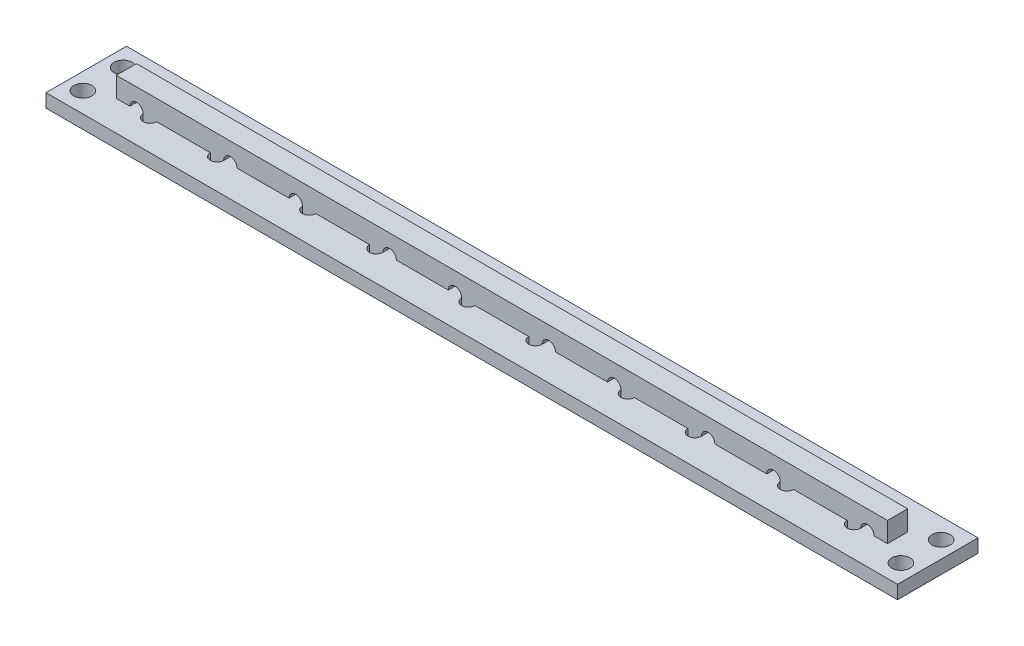
from build123d import *

# Parameters (mm, degrees)
SKETCH_1_W      = 127
SKETCH_1_H      = 12
SKETCH_1_R      = 1.35
EXTRUDE_1_DEPTH = 2
EXTRUDE_2_DEPTH = 3


with BuildPart() as part:
    # 草图1 → 凸台-拉伸1 (new body)
    with BuildSketch(Plane(origin=(0, 0, 0), x_dir=(1, 0, 0), z_dir=(0, 1, 0))):
        with Locations((63.5, 6)):
            Rectangle(SKETCH_1_W, SKETCH_1_H)
        with Locations(Location((2.5, 9, 0), (0, 0, 270))):
            Circle(SKETCH_1_R, mode=Mode.SUBTRACT)
        with Locations(Location((2.5, 3, 0), (0, 0, 90))):
            Circle(SKETCH_1_R, mode=Mode.SUBTRACT)
        with Locations(Location((124.5, 3, 0), (0, 0, 270))):
            Circle(SKETCH_1_R, mode=Mode.SUBTRACT)
        with Locations(Location((124.5, 9, 0), (0, 0, 90))):
            Circle(SKETCH_1_R, mode=Mode.SUBTRACT)
        with BuildLine():
            Line((12, 7.5), (20, 7.5))
            ThreePointArc((20, 7.5), (21, 8.5), (22, 7.5))
            Line((22, 7.5), (22, 4.5))
            ThreePointArc((22, 4.5), (21, 3.5), (20, 4.5))
            Line((20, 4.5), (12, 4.5))
            ThreePointArc((12, 4.5), (11, 3.5), (10, 4.5))
            Line((10, 4.5), (10, 7.5))
            ThreePointArc((10, 7.5), (11, 8.5), (12, 7.5))
        make_face(mode=Mode.SUBTRACT)
        with BuildLine():
            Line((35.75, 4.5), (43.75, 4.5))
            ThreePointArc((43.75, 4.5), (44.75, 3.5), (45.75, 4.5))
            Line((45.75, 4.5), (45.75, 7.5))
            ThreePointArc((45.75, 7.5), (44.75, 8.5), (43.75, 7.5))
            Line((43.75, 7.5), (35.75, 7.5))
            ThreePointArc((35.75, 7.5), (34.75, 8.5), (33.75, 7.5))
            Line((33.75, 7.5), (33.75, 4.5))
            ThreePointArc((33.75, 4.5), (34.75, 3.5), (35.75, 4.5))
        make_face(mode=Mode.SUBTRACT)
        with BuildLine():
            Line((59.5, 4.5), (67.5, 4.5))
            ThreePointArc((67.5, 4.5), (68.5, 3.5), (69.5, 4.5))
            Line((69.5, 4.5), (69.5, 7.5))
            ThreePointArc((69.5, 7.5), (68.5, 8.5), (67.5, 7.5))
            Line((67.5, 7.5), (59.5, 7.5))
            ThreePointArc((59.5, 7.5), (58.5, 8.5), (57.5, 7.5))
            Line((57.5, 7.5), (57.5, 4.5))
            ThreePointArc((57.5, 4.5), (58.5, 3.5), (59.5, 4.5))
        make_face(mode=Mode.SUBTRACT)
        with BuildLine():
            Line((83.25, 4.5), (91.25, 4.5))
            ThreePointArc((91.25, 4.5), (92.25, 3.5), (93.25, 4.5))
            Line((93.25, 4.5), (93.25, 7.5))
            ThreePointArc((93.25, 7.5), (92.25, 8.5), (91.25, 7.5))
            Line((91.25, 7.5), (83.25, 7.5))
            ThreePointArc((83.25, 7.5), (82.25, 8.5), (81.25, 7.5))
            Line((81.25, 7.5), (81.25, 4.5))
            ThreePointArc((81.25, 4.5), (82.25, 3.5), (83.25, 4.5))
        make_face(mode=Mode.SUBTRACT)
        with BuildLine():
            Line((107, 4.5), (115, 4.5))
            ThreePointArc((115, 4.5), (116, 3.5), (117, 4.5))
            Line((117, 4.5), (117, 7.5))
            ThreePointArc((117, 7.5), (116, 8.5), (115, 7.5))
            Line((115, 7.5), (107, 7.5))
            ThreePointArc((107, 7.5), (106, 8.5), (105, 7.5))
            Line((105, 7.5), (105, 4.5))
            ThreePointArc((105, 4.5), (106, 3.5), (107, 4.5))
        make_face(mode=Mode.SUBTRACT)
    extrude(amount=EXTRUDE_1_DEPTH)


with BuildPart() as body_2:
    # 草图2 → 凸台-拉伸2 (new body)
    with BuildSketch(Plane.XY.offset(-7.5)):
        with BuildLine():
            Line((22, 0), (22, 2))
            ThreePointArc((22, 2), (23, 3), (24, 2))
            Line((24, 2), (31.75, 2))
            ThreePointArc((31.75, 2), (32.75, 3), (33.75, 2))
            Line((33.75, 2), (33.75, 0))
            Line((33.75, 0), (33.75, -2))
            Line((33.75, -2), (45.75, -2))
            Line((45.75, -2), (45.75, 0))
            Line((45.75, 0), (45.75, 2))
            ThreePointArc((45.75, 2), (46.75, 3), (47.75, 2))
            Line((47.75, 2), (55.5, 2))
            ThreePointArc((55.5, 2), (56.5, 3), (57.5, 2))
            Line((57.5, 2), (57.5, 0))
            Line((57.5, 0), (57.5, -2))
            Line((57.5, -2), (69.5, -2))
            Line((69.5, -2), (69.5, 0))
            Line((69.5, 0), (69.5, 2))
            ThreePointArc((69.5, 2), (70.5, 3), (71.5, 2))
            Line((71.5, 2), (79.25, 2))
            ThreePointArc((79.25, 2), (80.25, 3), (81.25, 2))
            Line((81.25, 2), (81.25, 0))
            Line((81.25, 0), (81.25, -2))
            Line((81.25, -2), (93.25, -2))
            Line((93.25, -2), (93.25, 0))
            Line((93.25, 0), (93.25, 2))
            ThreePointArc((93.25, 2), (94.25, 3), (95.25, 2))
            Line((95.25, 2), (103, 2))
            ThreePointArc((103, 2), (104, 3), (105, 2))
            Line((105, 2), (105, 0))
            Line((105, 0), (105, -2))
            Line((105, -2), (117, -2))
            Line((117, -2), (117, 0))
            Line((117, 0), (117, 2))
            ThreePointArc((117, 2), (118, 3), (119, 2))
            Line((119, 2), (121, 2))
            Line((121, 2), (121, 5))
            Line((121, 5), (6, 5))
            Line((6, 5), (6, 2))
            Line((6, 2), (8, 2))
            ThreePointArc((8, 2), (9, 3), (10, 2))
            Line((10, 2), (10, 0))
            Line((10, 0), (10, -2))
            Line((10, -2), (22, -2))
            Line((22, -2), (22, 0))
        make_face()
    extrude(amount=EXTRUDE_2_DEPTH)


solid = Compound([part.part, body_2.part])
